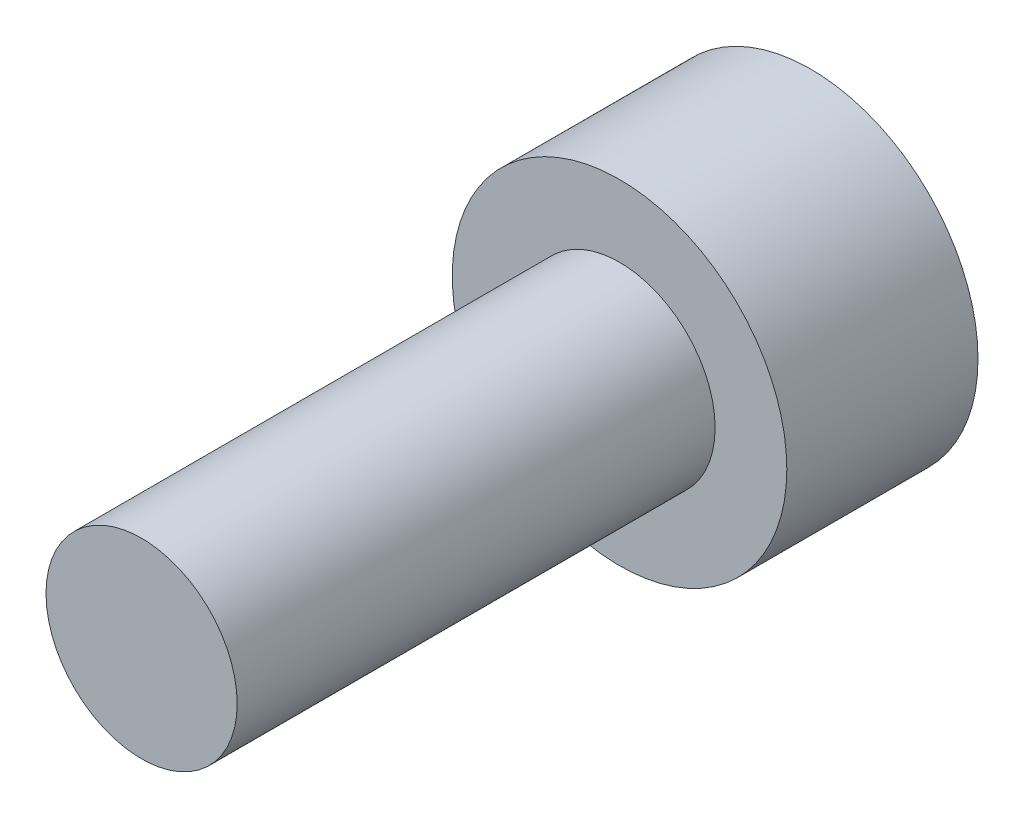
from build123d import *

# Parameters (mm, degrees)
CABEZA_START            = -4
CROQUIS1_R              = 3.5
CABEZA_DEPTH            = 4
CROQUIS2_R              = 2
CUERPO_DEPTH            = 10
HEXAGONO_INTERIOR_START = -4
HEXAGONO_INTERIOR_DEPTH = 2


with BuildPart() as part:
    # Croquis1 → Cabeza (new body)
    with BuildSketch(Plane.XY.offset(CABEZA_START)):
        Circle(CROQUIS1_R)
    extrude(amount=CABEZA_DEPTH)

    # Croquis2 → Cuerpo (add)
    with BuildSketch(Plane.XY):
        Circle(CROQUIS2_R)
    extrude(amount=CUERPO_DEPTH)

    # Croquis3 → Hexagono_interior (cut)
    with BuildSketch(Plane.XY.offset(HEXAGONO_INTERIOR_START)):
        Polygon((1.732050808, 0), (0.866025404, 1.5), (-0.866025404, 1.5), (-1.732050808, 0), (-0.866025404, -1.5), (0.866025404, -1.5), align=None)
    extrude(amount=HEXAGONO_INTERIOR_DEPTH, mode=Mode.SUBTRACT)


solid = part.part
